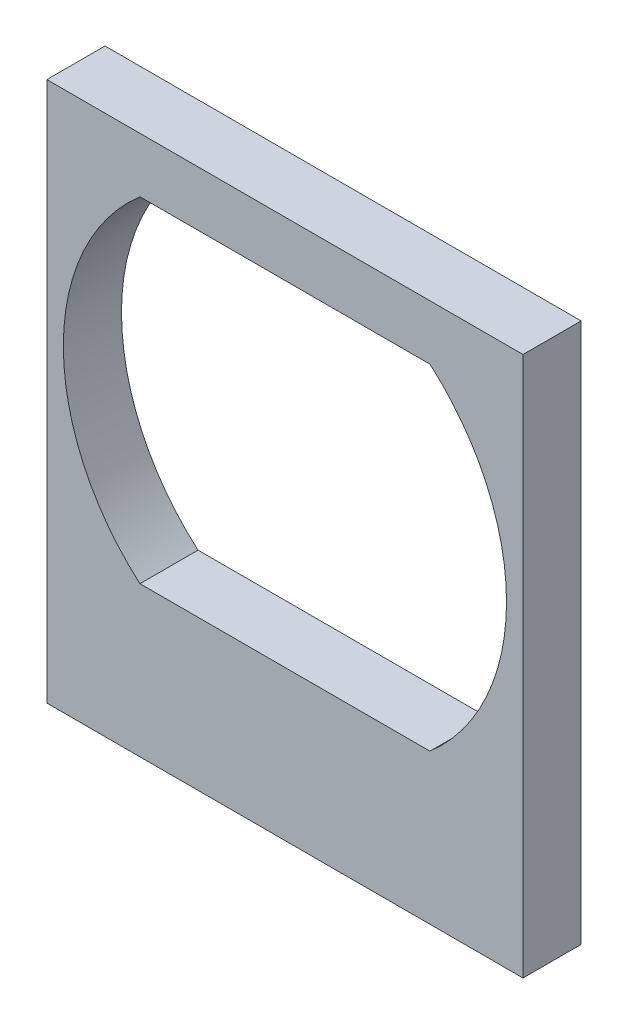
from build123d import *

# Parameters (mm, degrees)
SKETCH2_W                             = 29.487
SKETCH2_H                             = 26
BOSS_EXTRUDE1_DEPTH                   = 3.175
CUT_EXTRUDE1_DEPTH                    = 22.900963312
TAP_DRILL_FOR_M3X0_5_TAP1_D           = 2.5
TAP_DRILL_FOR_M3X0_5_TAP1_DEPTH       = 6
TAP_DRILL_FOR_M3X0_5_TAP1_CSINK_D     = 2.55
TAP_DRILL_FOR_M3X0_5_TAP1_CSINK_ANGLE = 90
TAP_DRILL_FOR_M3X0_5_TAP1_TIP         = 0.751075774


with BuildPart() as part:
    # Sketch2 → Boss-Extrude1 (new body)
    with BuildSketch(Plane(origin=(0, 0, 0), x_dir=(0, 1, 0), z_dir=(0, 0, 1))):
        with Locations((-2.5935, 0)):
            Rectangle(SKETCH2_W, SKETCH2_H)
    extrude(amount=BOSS_EXTRUDE1_DEPTH)

    # Sketch1 → Cut-Extrude1 (cut, through all)
    with BuildSketch(Plane(origin=(0, 0, 0), x_dir=(0, 1, 0), z_dir=(0, 0, 1))):
        with BuildLine():
            Line((-9.15, 7.917543811), (-9.15, -7.917543811))
            ThreePointArc((-9.15, -7.917543811), (0, -12.1), (9.15, -7.917543811))
            Line((9.15, -7.917543811), (9.15, 7.917543811))
            ThreePointArc((9.15, 7.917543811), (0, 12.1), (-9.15, 7.917543811))
        make_face()
    extrude(amount=CUT_EXTRUDE1_DEPTH, mode=Mode.SUBTRACT)

    # Tap Drill for M3x0.5 Tap1
    with Locations(Plane(origin=(0, -17.337, 0), x_dir=(-1, 0, 0), z_dir=(0, -1, 0))):
        with Locations((-7.5, -1.5875), (7.5, -1.5875)):
            CounterSinkHole(TAP_DRILL_FOR_M3X0_5_TAP1_D / 2, TAP_DRILL_FOR_M3X0_5_TAP1_CSINK_D / 2, depth=TAP_DRILL_FOR_M3X0_5_TAP1_DEPTH, counter_sink_angle=TAP_DRILL_FOR_M3X0_5_TAP1_CSINK_ANGLE)
            with Locations((0, 0, -(TAP_DRILL_FOR_M3X0_5_TAP1_DEPTH + TAP_DRILL_FOR_M3X0_5_TAP1_TIP / 2))):  # 118° drill point
                Cone(0, TAP_DRILL_FOR_M3X0_5_TAP1_D / 2, TAP_DRILL_FOR_M3X0_5_TAP1_TIP, mode=Mode.SUBTRACT)


solid = part.part
